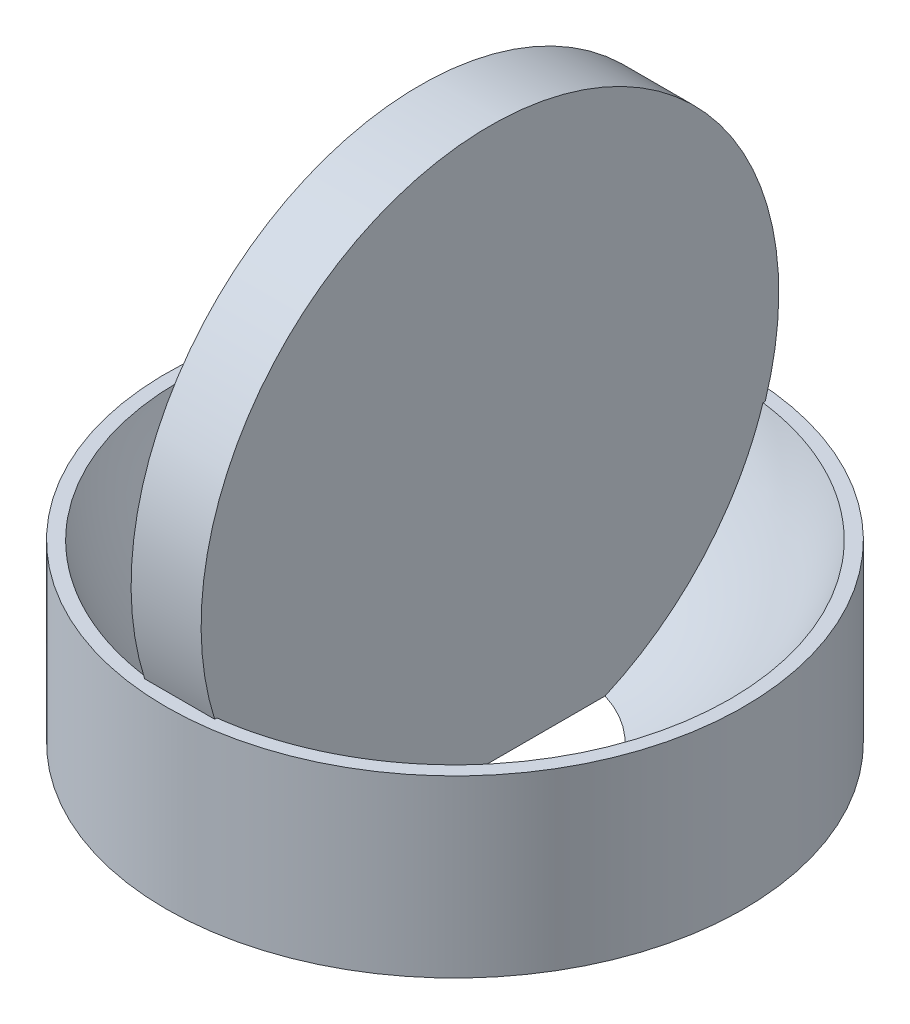
from build123d import *

# Parameters (mm, degrees)
CROQUIS1_R              = 8.25
SALIENTE_EXTRUIR1_DEPTH = 5
CROQUIS11_R             = 8.25
SALIENTE_EXTRUIR2_DEPTH = 1
CROQUIS13_W             = 16.491898527
CROQUIS13_H             = 1.592253137
CORTAR_EXTRUIR11_DEPTH  = 25.32457605


with BuildPart() as part:
    # Croquis1 → Saliente-Extruir1 (new body)
    with BuildSketch(Plane(origin=(0, 0, 0), x_dir=(1, 0, 0), z_dir=(0, 1, 0))):
        with Locations(Location((0, 0, 0), (0, 0, 270))):
            Circle(CROQUIS1_R)
    extrude(amount=SALIENTE_EXTRUIR1_DEPTH)

    # Croquis10 → Cortar-Revolución1 (revolve, cut)
    with BuildSketch(Plane(origin=(0, 7.5, 0), x_dir=(1, 0, 0), z_dir=(0, 1, 0))):
        with BuildLine():
            Line((0, 8.25), (0, -8.25))
            ThreePointArc((0, -8.25), (8.25, 0), (0, 8.25))
        make_face()
    revolve(axis=Axis((0, 7.5, -8.25), (0, 0, 1)), mode=Mode.SUBTRACT)

    # Croquis11 → Saliente-Extruir2 (add, symmetric)
    with BuildSketch(Plane(origin=(0, 0, 0), x_dir=(0, 0, -1), z_dir=(1, 0, 0))):
        with Locations((0, 7.5)):
            Circle(CROQUIS11_R)
    extrude(amount=SALIENTE_EXTRUIR2_DEPTH, both=True)

    # Croquis13 → Cortar-Extruir11 (cut, through all)
    with BuildSketch(Plane.XY.offset(-8.35)):
        with Locations((-0.004050736, -0.796126569)):
            Rectangle(CROQUIS13_W, CROQUIS13_H)
    extrude(amount=CORTAR_EXTRUIR11_DEPTH, mode=Mode.SUBTRACT)


solid = part.part
